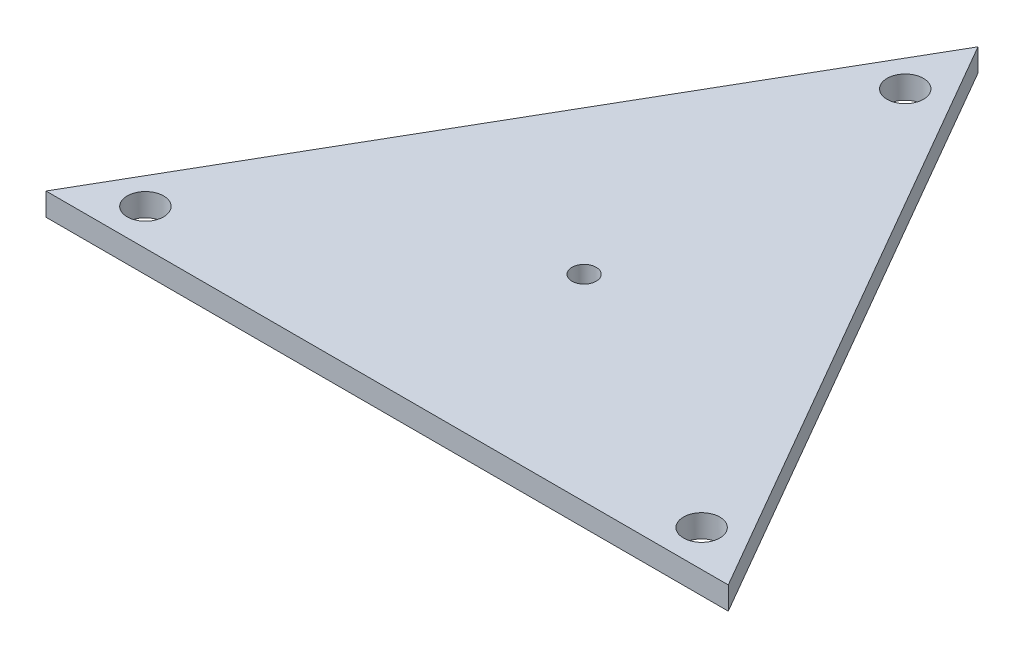
from build123d import *

# Parameters (mm, degrees)
BOSS_EXTRUDE1_DEPTH     = 5
CUT_EXTRUDE1_DEPTH      = 151.083310198
CUT_EXTRUDE1_DEPTH_BACK = 151.083310198
SKETCH2_R               = 4
SKETCH2_R_2             = 2.665209895


with BuildPart() as part:
    # Sketch1 → Boss-Extrude1 (new body)
    with BuildSketch(Plane(origin=(0, 0, 0), x_dir=(1, 0, 0), z_dir=(0, 1, 0))):
        Polygon((0, 129.903810568), (75, 0), (-75, 0), align=None)
    extrude(amount=BOSS_EXTRUDE1_DEPTH)

    # Sketch2 → Cut-Extrude1 (cut, two sides: drawn at the far end of the back side and taken through both)
    with BuildSketch(Plane(origin=(0, 5, 0), x_dir=(1, 0, 0), z_dir=(0, 1, 0)).offset(-CUT_EXTRUDE1_DEPTH_BACK)):
        with Locations(Location((-61.143593539, 8, 0), (0, 0, 270))):
            Circle(SKETCH2_R)
        with Locations(Location((61.143593539, 8, 0), (0, 0, 270))):
            Circle(SKETCH2_R)
        with Locations(Location((0, 113.903810568, 0), (0, 0, 270))):
            Circle(SKETCH2_R)
        with Locations(Location((0, 43.301270189, 0), (0, 0, 270))):
            Circle(SKETCH2_R_2)
    extrude(amount=CUT_EXTRUDE1_DEPTH + CUT_EXTRUDE1_DEPTH_BACK, mode=Mode.SUBTRACT)


solid = part.part
